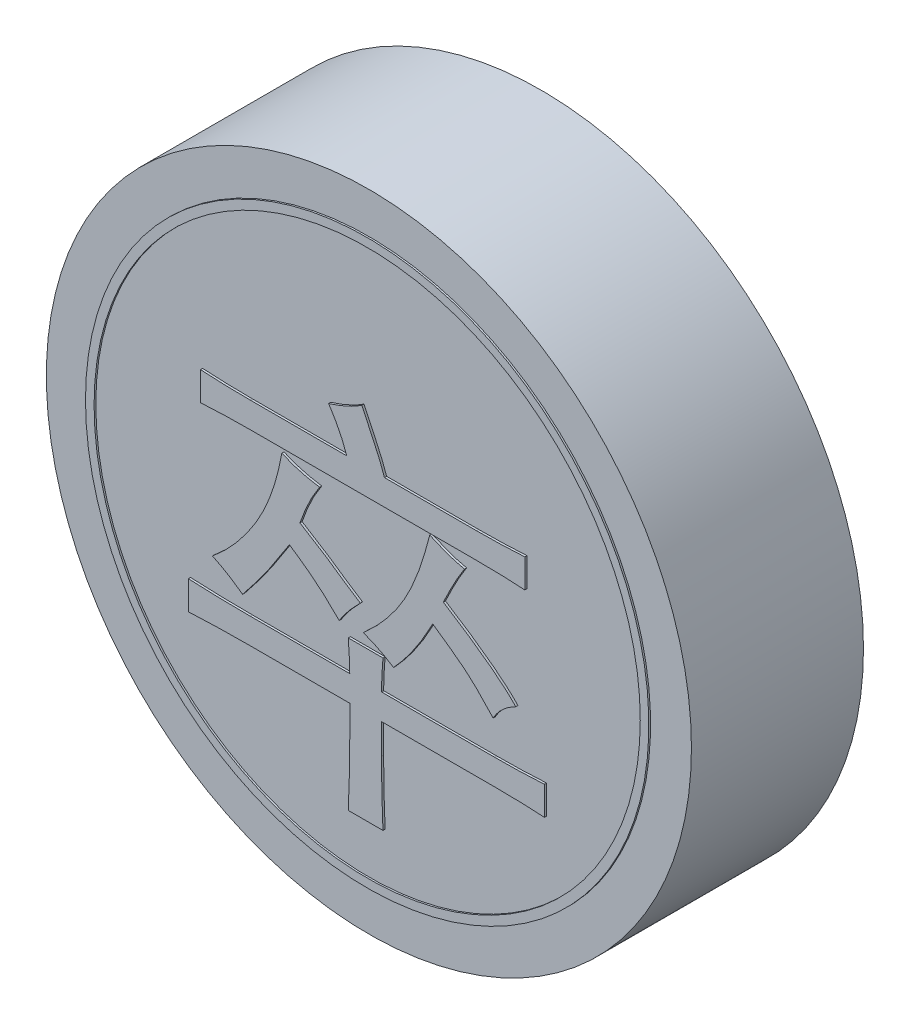
from build123d import *

# Parameters (mm, degrees)
SKETCH_1_R               = 15
DIAMETER30_HEIGHT8_DEPTH = 8
CHARACTER_DEPTH          = 0.1
SKETCH_3_R               = 13.1
SKETCH_3_R_2             = 12.7
INK_RING_DEPTH           = 0.08


with BuildPart() as part:
    # 草图1 → Diameter30_Height8 (new body)
    with BuildSketch(Plane.XY):
        Circle(SKETCH_1_R)
    extrude(amount=-DIAMETER30_HEIGHT8_DEPTH)

    # 草图2 → Character_卒 (add)
    with BuildSketch(Plane.XY):
        with BuildLine():
            add(Edge.make_bspline(
                [(-0.789473684, -4.850877193), (-0.790801429, -4.759897806), (-0.793710801, -4.56054267), (-0.807970927, -4.235644823), (-0.827994939, -3.858637974), (-0.848649707, -3.590279221), (-0.859649123, -3.447368421)],
                knots=[0, 0, 0, 0, 0.776803547, 1.702141345, 2.77630666, 4, 4, 4, 4], degree=3))
            Line((-0.859649123, -3.447368421), (0.754385965, -3.447368421))
            add(Edge.make_bspline(
                [(0.754385965, -3.447368421), (0.743322045, -3.581608953), (0.722136363, -3.838658655), (0.702337175, -4.207039208), (0.688146654, -4.540612928), (0.685474648, -4.751233078), (0.684210526, -4.850877193)],
                knots=[0, 0, 0, 0, 1.149871826, 2.201825379, 3.14928596, 4, 4, 4, 4], degree=3))
            Line((0.684210526, -4.850877193), (5.947368421, -4.850877193))
            add(Edge.make_bspline(
                [(5.947368421, -4.850877193), (6.153571591, -4.849759117), (6.557354449, -4.847569722), (7.149120938, -4.833995367), (7.715061172, -4.814883935), (8.082995961, -4.791937596), (8.263157895, -4.780701754)],
                knots=[0, 0, 0, 0, 1.067833177, 2.091009239, 3.065248851, 4, 4, 4, 4], degree=3))
            Line((8.263157895, -4.780701754), (8.263157895, -6.114035088))
            add(Edge.make_bspline(
                [(8.263157895, -6.114035088), (8.084728409, -6.102816563), (7.722852753, -6.080064096), (7.169915527, -6.060827798), (6.599807697, -6.04723991), (6.213350691, -6.044996382), (6.01754386, -6.043859649)],
                knots=[0, 0, 0, 0, 0.954695298, 1.936232608, 2.954347453, 4, 4, 4, 4], degree=3))
            Line((6.01754386, -6.043859649), (0.684210526, -6.043859649))
            Line((0.684210526, -6.043859649), (0.684210526, -7.447368421))
            add(Edge.make_bspline(
                [(0.684210526, -7.447368421), (0.685397037, -7.683891967), (0.687800644, -8.163035928), (0.701667727, -8.890804431), (0.721199551, -9.636859607), (0.743233706, -10.140053014), (0.754385965, -10.394736842)],
                knots=[0, 0, 0, 0, 0.962642255, 1.950098551, 2.962472993, 4, 4, 4, 4], degree=3))
            Line((0.754385965, -10.394736842), (-0.859649123, -10.394736842))
            add(Edge.make_bspline(
                [(-0.859649123, -10.394736842), (-0.848496864, -10.140053014), (-0.826462709, -9.636859607), (-0.806930884, -8.890804431), (-0.793063802, -8.163035928), (-0.790660195, -7.683891967), (-0.789473684, -7.447368421)],
                knots=[0, 0, 0, 0, 1.037527007, 2.049901449, 3.037357745, 4, 4, 4, 4], degree=3))
            Line((-0.789473684, -7.447368421), (-0.789473684, -6.043859649))
            Line((-0.789473684, -6.043859649), (-5.421052632, -6.043859649))
            add(Edge.make_bspline(
                [(-5.421052632, -6.043859649), (-5.682701779, -6.044953947), (-6.191304061, -6.047081081), (-6.932940468, -6.060737801), (-7.630551811, -6.079416677), (-8.08082403, -6.102762271), (-8.298245614, -6.114035088)],
                knots=[0, 0, 0, 0, 1.090812078, 2.120356657, 3.092382303, 4, 4, 4, 4], degree=3))
            Line((-8.298245614, -6.114035088), (-8.298245614, -4.780701754))
            add(Edge.make_bspline(
                [(-8.298245614, -4.780701754), (-8.08082403, -4.791974571), (-7.630551811, -4.815320165), (-6.932940468, -4.833999041), (-6.191304061, -4.847655761), (-5.682701779, -4.849782895), (-5.421052632, -4.850877193)],
                knots=[0, 0, 0, 0, 0.907617697, 1.879643343, 2.909187922, 4, 4, 4, 4], degree=3))
            Line((-5.421052632, -4.850877193), (-0.789473684, -4.850877193))
        make_face()
        with BuildLine():
            add(Edge.make_bspline(
                [(-0.228070175, 6.236842105), (-0.156109894, 6.086120817), (-0.019362397, 5.799702277), (0.174042946, 5.392534756), (0.339217718, 5.027307778), (0.485673111, 4.708835423), (0.607257942, 4.433181617), (0.697833971, 4.199102721), (0.775068508, 4.01240031), (0.809623929, 3.899626563), (0.824561404, 3.850877193)],
                knots=[0, 0, 0, 0, 1.536129931, 2.919137034, 4.145724164, 5.222612619, 6.143346331, 6.915728762, 7.531295706, 8, 8, 8, 8], degree=3))
            Line((0.824561404, 3.850877193), (5.105263158, 3.850877193))
            add(Edge.make_bspline(
                [(5.105263158, 3.850877193), (5.479619966, 3.854131443), (6.228685366, 3.860643001), (6.976696154, 3.900909785), (7.350877193, 3.921052632)],
                knots=[0, 0, 0, 0, 0.999530368, 2, 2, 2, 2], degree=3))
            Line((7.350877193, 3.921052632), (7.350877193, 2.587719298))
            add(Edge.make_bspline(
                [(7.350877193, 2.587719298), (7.172447708, 2.598937823), (6.810572051, 2.62169029), (6.257634825, 2.640926588), (5.687526995, 2.654514476), (5.301069989, 2.656758004), (5.105263158, 2.657894737)],
                knots=[0, 0, 0, 0, 0.954695298, 1.936232608, 2.954347453, 4, 4, 4, 4], degree=3))
            Line((5.105263158, 2.657894737), (-5.421052632, 2.657894737))
            add(Edge.make_bspline(
                [(-5.421052632, 2.657894737), (-5.812739886, 2.65481161), (-6.585197979, 2.648731285), (-7.356594534, 2.607864115), (-7.736842105, 2.587719298)],
                knots=[0, 0, 0, 0, 1.014132048, 2, 2, 2, 2], degree=3))
            Line((-7.736842105, 2.587719298), (-7.736842105, 3.921052632))
            add(Edge.make_bspline(
                [(-7.736842105, 3.921052632), (-7.356594534, 3.900907815), (-6.585197979, 3.860040645), (-5.812739886, 3.85396032), (-5.421052632, 3.850877193)],
                knots=[0, 0, 0, 0, 0.985867952, 2, 2, 2, 2], degree=3))
            Line((-5.421052632, 3.850877193), (-0.929824561, 3.850877193))
            add(Edge.make_bspline(
                [(-0.929824561, 3.850877193), (-0.980684131, 3.992024122), (-1.083871457, 4.278392539), (-1.278672781, 4.700093895), (-1.507170176, 5.121999254), (-1.682656017, 5.395799197), (-1.771929825, 5.535087719)],
                knots=[0, 0, 0, 0, 0.953125153, 1.933764644, 2.948857086, 4, 4, 4, 4], degree=3))
            add(Edge.make_bspline(
                [(-1.771929825, 5.535087719), (-1.62459993, 5.58202295), (-1.338428862, 5.673189138), (-0.936560558, 5.846379126), (-0.563050889, 6.023276607), (-0.337677387, 6.166962504), (-0.228070175, 6.236842105)],
                knots=[0, 0, 0, 0, 1.089780509, 2.116771012, 3.084118242, 4, 4, 4, 4], degree=3))
        make_face()
        with BuildLine():
            add(Edge.make_bspline(
                [(-7.175438596, -3.307017544), (-6.98048316, -3.1382579), (-6.588845128, -2.799243528), (-6.061608465, -2.221053989), (-5.568647742, -1.59964673), (-5.203410344, -1.036895342), (-4.931938508, -0.561218149), (-4.747044901, -0.182556888), (-4.574161763, 0.21271815), (-4.415558738, 0.624148149), (-4.275946384, 1.056025341), (-4.148412897, 1.502931906), (-4.039067969, 1.969000373), (-3.978302297, 2.285996), (-3.947368421, 2.447368421)],
                knots=[0, 0, 0, 0, 1.375491815, 2.763169447, 4.169597174, 5.606384173, 6.339559252, 7.092484169, 7.85468537, 8.642352472, 9.44533771, 10.276970463, 11.122860306, 12, 12, 12, 12], degree=3))
            add(Edge.make_bspline(
                [(-3.947368421, 2.447368421), (-3.814656433, 2.391803417), (-3.54492517, 2.278869996), (-3.118673203, 2.141123125), (-2.665766045, 2.031947853), (-2.352791689, 1.98176463), (-2.192982456, 1.956140351)],
                knots=[0, 0, 0, 0, 0.944361974, 1.919374057, 2.937602298, 4, 4, 4, 4], degree=3))
            add(Edge.make_bspline(
                [(-2.192982456, 1.956140351), (-2.284293234, 1.812685301), (-2.468653393, 1.523043743), (-2.709943098, 1.060656442), (-2.922722695, 0.571568579), (-3.043931186, 0.232814436), (-3.105263158, 0.061403509)],
                knots=[0, 0, 0, 0, 0.967322235, 1.953062777, 2.964241725, 4, 4, 4, 4], degree=3))
            add(Edge.make_bspline(
                [(-3.105263158, 0.061403509), (-3.020228191, 0.010504163), (-2.855762835, -0.087939797), (-2.619989225, -0.233850972), (-2.400530295, -0.369430286), (-2.198029978, -0.495811494), (-2.014389128, -0.615899211), (-1.846910459, -0.724242679), (-1.699279535, -0.826802965), (-1.516932472, -0.950576249), (-1.289766439, -1.115157015), (-0.98850906, -1.312321987), (-0.657510176, -1.535390238), (-0.421660264, -1.684915094), (-0.298245614, -1.763157895)],
                knots=[0, 0, 0, 0, 1.065426832, 2.060632332, 2.980788783, 3.838740189, 4.626696748, 5.339690255, 5.982964193, 6.559079281, 7.708973115, 8.998013454, 10.429131845, 12, 12, 12, 12], degree=3))
            add(Edge.make_bspline(
                [(-0.298245614, -1.763157895), (-0.398983324, -1.866099762), (-0.592943538, -2.064303858), (-0.855906896, -2.367663443), (-1.087553396, -2.659506482), (-1.217997872, -2.859840826), (-1.280701754, -2.956140351)],
                knots=[0, 0, 0, 0, 1.115835912, 2.148428553, 3.109960639, 4, 4, 4, 4], degree=3))
            add(Edge.make_bspline(
                [(-1.280701754, -2.956140351), (-1.392981851, -2.84575781), (-1.607095735, -2.635262495), (-1.916319833, -2.342034468), (-2.201826683, -2.090084909), (-2.555473971, -1.80068924), (-3.014548048, -1.456793306), (-3.396105984, -1.197551304), (-3.596491228, -1.061403509)],
                knots=[0, 0, 0, 0, 0.945286653, 1.802625772, 2.558111326, 3.230756287, 4.54565841, 6, 6, 6, 6], degree=3))
            add(Edge.make_bspline(
                [(-3.596491228, -1.061403509), (-3.677005016, -1.187063521), (-3.834269518, -1.432510416), (-4.066143699, -1.792254053), (-4.289014727, -2.134905351), (-4.512900431, -2.472857319), (-4.756501985, -2.828813939), (-5.048766257, -3.221941743), (-5.389492428, -3.670215688), (-5.639535127, -3.983331586), (-5.771929825, -4.149122807)],
                knots=[0, 0, 0, 0, 0.947604617, 1.85091985, 2.717562405, 3.542964283, 4.424922328, 5.455851291, 6.65290289, 8, 8, 8, 8], degree=3))
            add(Edge.make_bspline(
                [(-5.771929825, -4.149122807), (-5.896852759, -4.06059604), (-6.137481231, -3.890074424), (-6.496341391, -3.660207888), (-6.83908116, -3.466386711), (-7.06651396, -3.358627013), (-7.175438596, -3.307017544)],
                knots=[0, 0, 0, 0, 1.120543842, 2.158408734, 3.118004707, 4, 4, 4, 4], degree=3))
        make_face()
        with BuildLine():
            add(Edge.make_bspline(
                [(4.543859649, 2.026315789), (4.469975902, 1.910021666), (4.309750845, 1.657825028), (4.075909531, 1.234739939), (3.820958713, 0.743415704), (3.651325566, 0.389411189), (3.561403509, 0.201754386)],
                knots=[0, 0, 0, 0, 0.797117921, 1.728638155, 2.795957437, 4, 4, 4, 4], degree=3))
            add(Edge.make_bspline(
                [(3.561403509, 0.201754386), (3.758505993, 0.076814066), (4.138264217, -0.163908999), (4.680262127, -0.52293061), (5.173532329, -0.86614998), (5.620763562, -1.188726592), (6.016907487, -1.496709829), (6.366499894, -1.784851945), (6.669366457, -2.055358757), (6.846736443, -2.23868371), (6.929824561, -2.324561404)],
                knots=[0, 0, 0, 0, 1.327108154, 2.556945121, 3.696800934, 4.744383079, 5.692453866, 6.549752354, 7.320638453, 8, 8, 8, 8], degree=3))
            add(Edge.make_bspline(
                [(6.929824561, -2.324561404), (6.817447827, -2.385098573), (6.597967485, -2.503332287), (6.313249187, -2.738566552), (6.064388321, -3.001005035), (5.93967435, -3.204877821), (5.877192982, -3.307017544)],
                knots=[0, 0, 0, 0, 1.045766307, 2.042461452, 3.019278403, 4, 4, 4, 4], degree=3))
            add(Edge.make_bspline(
                [(5.877192982, -3.307017544), (5.765310551, -3.185014254), (5.552795255, -2.953274876), (5.23937661, -2.634952044), (4.958962948, -2.353416276), (4.728529418, -2.151752811), (4.547327904, -1.996466107), (4.39214823, -1.878488863), (4.220615611, -1.744830294), (4.029887052, -1.599967896), (3.817264655, -1.446541037), (3.586848176, -1.279791215), (3.334895023, -1.104029856), (3.160322937, -0.98336362), (3.070175439, -0.921052632)],
                knots=[0, 0, 0, 0, 1.612216372, 3.062327431, 4.351272069, 5.480958766, 6.043892015, 6.675219284, 7.379081896, 8.162202959, 9.007845852, 9.932916552, 10.93257619, 12, 12, 12, 12], degree=3))
            add(Edge.make_bspline(
                [(3.070175439, -0.921052632), (2.930514441, -1.180277916), (2.659259379, -1.68375542), (2.209696422, -2.385917946), (1.748001726, -3.02305322), (1.409856854, -3.403116152), (1.245614035, -3.587719298)],
                knots=[0, 0, 0, 0, 1.090056543, 2.117150532, 3.085467416, 4, 4, 4, 4], degree=3))
            add(Edge.make_bspline(
                [(1.245614035, -3.587719298), (1.138153716, -3.518750761), (0.922019744, -3.380034964), (0.578909927, -3.19530879), (0.218536354, -3.028855461), (-0.03166829, -2.933879569), (-0.157894737, -2.885964912)],
                knots=[0, 0, 0, 0, 0.973872776, 1.958741545, 2.970199756, 4, 4, 4, 4], degree=3))
            add(Edge.make_bspline(
                [(-0.157894737, -2.885964912), (0.033942517, -2.709635903), (0.410576218, -2.363449509), (0.915487717, -1.801476897), (1.360095455, -1.219507278), (1.684798143, -0.711523457), (1.912476358, -0.282934148), (2.080859113, 0.05825593), (2.236892028, 0.424811579), (2.391534722, 0.81230225), (2.536718133, 1.223418604), (2.673088755, 1.657482031), (2.80708242, 2.113797372), (2.888251647, 2.42720136), (2.929824561, 2.587719298)],
                knots=[0, 0, 0, 0, 1.46582543, 2.877852168, 4.245122148, 5.584316448, 6.264949613, 6.97585841, 7.724954112, 8.506361158, 9.323726205, 10.178041031, 11.066836706, 12, 12, 12, 12], degree=3))
            add(Edge.make_bspline(
                [(2.929824561, 2.587719298), (3.076473605, 2.522091404), (3.359300137, 2.395521813), (3.776621741, 2.237680667), (4.167581497, 2.112262132), (4.422129248, 2.054120441), (4.543859649, 2.026315789)],
                knots=[0, 0, 0, 0, 1.125667068, 2.170955253, 3.125310081, 4, 4, 4, 4], degree=3))
        make_face()
    extrude(amount=CHARACTER_DEPTH)

    # 草图3 → Ink_ring (add)
    with BuildSketch(Plane.XY):
        with Locations(Location((0, 0, 0), (0, 0, 180))):
            Circle(SKETCH_3_R)
        with Locations(Location((0, 0, 0), (0, 0, 180))):
            Circle(SKETCH_3_R_2, mode=Mode.SUBTRACT)
    extrude(amount=INK_RING_DEPTH)


solid = part.part
